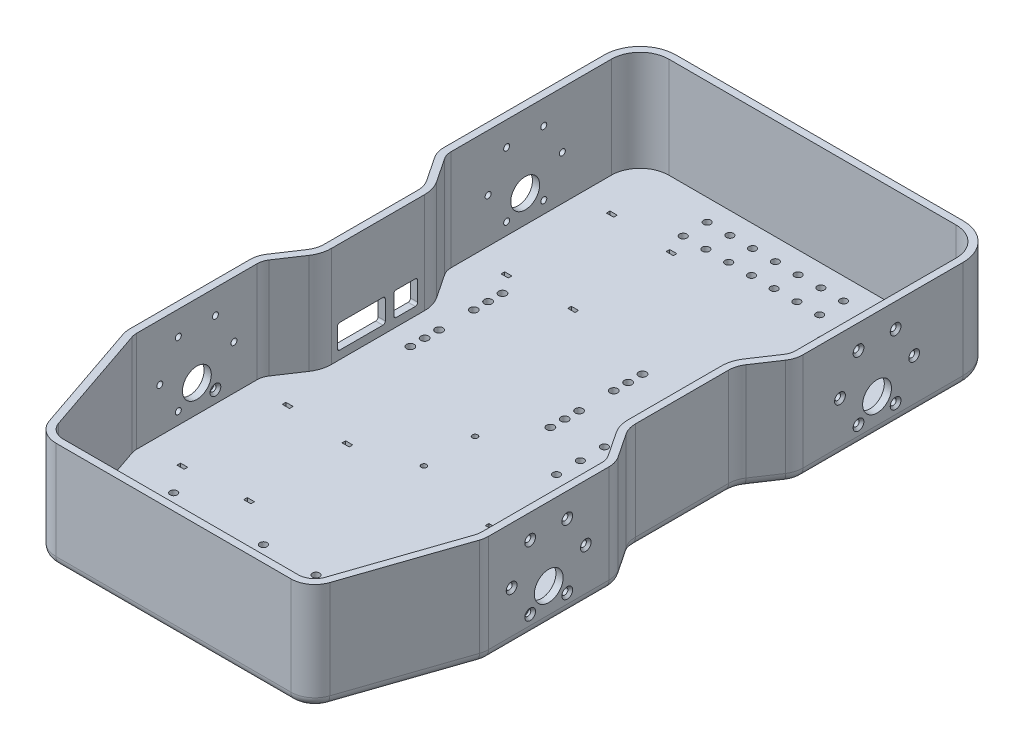
from build123d import *

# Parameters (mm, degrees)
BOSS_EXTRUDE1_DEPTH     = 45
SHELL1_T                = -3
CUT_EXTRUDE1_DEPTH      = 10
CUT_EXTRUDE1_DEPTH_BACK = 200
CUT_EXTRUDE2_DEPTH      = 10
CUT_EXTRUDE2_DEPTH_BACK = 200
CHAMFER1_SIZE           = 1
CHAMFER2_SIZE           = 1
CHAMFER3_SIZE           = 1
CHAMFER4_SIZE           = 1
SKETCH13_15_R           = 1.25
CUT_EXTRUDE11_DEPTH     = 214.424459704
CHAMFER5_SIZE           = 1
CUT_EXTRUDE12_DEPTH     = 214.424459704
FILLET1_R               = 4
CUT_EXTRUDE5_DEPTH      = 169.564527834
SKETCH19_R              = 1.125
CUT_EXTRUDE6_DEPTH      = 169.564527834
CUT_EXTRUDE7_DEPTH      = 10
SKETCH21_W              = 13.129743387
SKETCH21_H              = 8.501594807
CUT_EXTRUDE13_DEPTH     = 10
SKETCH25_W              = 3
SKETCH25_H              = 1.5
CUT_EXTRUDE14_DEPTH     = 10
CUT_EXTRUDE15_DEPTH     = 4
SKETCH31_R              = 1.6
CUT_EXTRUDE20_DEPTH     = 4
SKETCH32_R              = 1.5
CUT_EXTRUDE21_DEPTH     = 3


with BuildPart() as part:
    # Sketch1 → Boss-Extrude1 (new body)
    with BuildSketch(Plane(origin=(0, 0, 0), x_dir=(1, 0, 0), z_dir=(0, 1, 0))):
        with BuildLine():
            Line((-74.465101882, -71.56903448), (-58.559066155, -118.226739278))
            ThreePointArc((-58.559066155, -118.226739278), (-54.913440505, -123.132262686), (-49.093964273, -125))
            Line((-49.093964273, -125), (49.093964273, -125))
            ThreePointArc((49.093964273, -125), (54.913440505, -123.132262686), (58.559066155, -118.226739278))
            Line((58.559066155, -118.226739278), (74.465101882, -71.56903448))
            ThreePointArc((74.465101882, -71.56903448), (74.865369198, -69.977682187), (75, -68.342295202))
            Line((75, -68.342295202), (75, -18.027756377))
            ThreePointArc((75, -18.027756377), (74.570920265, -15.12991489), (73.320502943, -12.480754415))
            Line((73.320502943, -12.480754415), (66.679497057, -2.519245585))
            ThreePointArc((66.679497057, -2.519245585), (65.429079735, 0.12991489), (65, 3.027756377))
            Line((65, 3.027756377), (65, 41.972243623))
            ThreePointArc((65, 41.972243623), (65.429079735, 44.87008511), (66.679497057, 47.519245585))
            Line((66.679497057, 47.519245585), (73.320502943, 57.480754415))
            ThreePointArc((73.320502943, 57.480754415), (74.570920265, 60.12991489), (75, 63.027756377))
            Line((75, 63.027756377), (75, 130))
            ThreePointArc((75, 130), (70.606601718, 140.606601718), (60, 145))
            Line((60, 145), (-60, 145))
            ThreePointArc((-60, 145), (-70.606601718, 140.606601718), (-75, 130))
            Line((-75, 130), (-75, 63.027756377))
            ThreePointArc((-75, 63.027756377), (-74.570920265, 60.12991489), (-73.320502943, 57.480754415))
            Line((-73.320502943, 57.480754415), (-66.679497057, 47.519245585))
            ThreePointArc((-66.679497057, 47.519245585), (-65.429079735, 44.87008511), (-65, 41.972243623))
            Line((-65, 41.972243623), (-65, 3.027756377))
            ThreePointArc((-65, 3.027756377), (-65.429079735, 0.12991489), (-66.679497057, -2.519245585))
            Line((-66.679497057, -2.519245585), (-73.320502943, -12.480754415))
            ThreePointArc((-73.320502943, -12.480754415), (-74.570920265, -15.12991489), (-75, -18.027756377))
            Line((-75, -18.027756377), (-75, -68.342295202))
            ThreePointArc((-75, -68.342295202), (-74.865369198, -69.977682187), (-74.465101882, -71.56903448))
        make_face()
    extrude(amount=BOSS_EXTRUDE1_DEPTH)

    # Shell1
    shell1_openings = [part.faces().sort_by_distance(p)[0] for p in [
        (0, 45, -12.493815774),
    ]]
    offset(amount=SHELL1_T, openings=shell1_openings, kind=Kind.INTERSECTION)

    # Sketch13 → Cut-Extrude1 (cut, two sides: drawn at the far end of the back side and taken through both)
    with BuildSketch(Plane.ZY.offset(75).offset(-CUT_EXTRUDE1_DEPTH_BACK)):
        with BuildLine():
            ThreePointArc((37.397452028, 12.811795054), (49.208164475, 14.511751893), (37.380230416, 16.087428779))
            ThreePointArc((37.380230416, 16.087428779), (37.161887105, 14.448418707), (37.397452028, 12.811795054))
        make_face()
    extrude(amount=CUT_EXTRUDE1_DEPTH + CUT_EXTRUDE1_DEPTH_BACK, mode=Mode.SUBTRACT)

    # Sketch13<7> → Cut-Extrude2 (cut, two sides: drawn at the far end of the back side and taken through both)
    with BuildSketch(Plane.ZY.offset(75).offset(-CUT_EXTRUDE2_DEPTH_BACK)):
        with BuildLine():
            ThreePointArc((34.185026884, 34.921739832), (36.685025385, 34.922388021), (34.185031164, 34.927059157))
            ThreePointArc((34.185031164, 34.927059157), (34.185026194, 34.924399497), (34.185026884, 34.921739832))
        make_face()
        with BuildLine():
            ThreePointArc((26.435026884, 21.498346073), (28.935025385, 21.498994262), (26.435031164, 21.503665398))
            ThreePointArc((26.435031164, 21.503665398), (26.435026194, 21.501005738), (26.435026884, 21.498346073))
        make_face()
        with BuildLine():
            ThreePointArc((34.185026884, 8.074952315), (36.685025385, 8.075600503), (34.185031164, 8.08027164))
            ThreePointArc((34.185031164, 8.08027164), (34.185026194, 8.077611979), (34.185026884, 8.074952315))
        make_face()
        with BuildLine():
            ThreePointArc((52.185024696, 8.074952315), (49.685026194, 8.075600503), (52.185020416, 8.08027164))
            ThreePointArc((52.185020416, 8.08027164), (52.185025385, 8.077611979), (52.185024696, 8.074952315))
        make_face()
        with BuildLine():
            ThreePointArc((59.935024696, 21.498346073), (57.435026194, 21.498994262), (59.935020416, 21.503665398))
            ThreePointArc((59.935020416, 21.503665398), (59.935025385, 21.501005738), (59.935024696, 21.498346073))
        make_face()
        with BuildLine():
            ThreePointArc((52.185024696, 34.921739832), (49.685026194, 34.922388021), (52.185020416, 34.927059157))
            ThreePointArc((52.185020416, 34.927059157), (52.185025385, 34.924399497), (52.185024696, 34.921739832))
        make_face()
    extrude(amount=CUT_EXTRUDE2_DEPTH + CUT_EXTRUDE2_DEPTH_BACK, mode=Mode.SUBTRACT)

    # Chamfer1
    chamfer1_edges = [part.edges().sort_by_distance(p)[0] for p in [
        (-75, 34.91972836, 36.685020416),
    ]]
    chamfer(chamfer1_edges, length=CHAMFER1_SIZE)

    # Chamfer2
    chamfer2_edges = [part.edges().sort_by_distance(p)[0] for p in [
        (-75, 34.91972836, 49.685031164),
        (-75, 21.498994262, 57.435026194),
        (-75, 8.072940843, 49.685031164),
        (-72, 8.072940843, 36.685020416),
        (-75, 21.496334602, 28.935020416),
    ]]
    chamfer(chamfer2_edges, length=CHAMFER2_SIZE)

    # Chamfer3
    chamfer3_edges = [part.edges().sort_by_distance(p)[0] for p in [
        (-75, 8.072940843, 36.685020416),
    ]]
    chamfer(chamfer3_edges, length=CHAMFER3_SIZE)

    # Chamfer4
    chamfer4_edges = [part.edges().sort_by_distance(p)[0] for p in [
        (75, 34.91972836, 49.685031163),
        (75, 21.501005738, 59.935025385),
        (75, 8.072940843, 49.685031163),
        (72, 8.072940843, 49.685031163),
        (75, 8.072940843, 36.685020416),
        (75, 21.496334602, 28.935020416),
        (75, 34.91972836, 36.685020416),
    ]]
    chamfer(chamfer4_edges, length=CHAMFER4_SIZE)

    # Sketch13<15> → Cut-Extrude11 (cut, through all)
    with BuildSketch(Plane.ZY.offset(75)):
        with Locations((-86.25, 8.076606241)):
            Circle(SKETCH13_15_R)
        with Locations((-101.75, 8.076606241)):
            Circle(SKETCH13_15_R)
        with Locations((-101.75, 34.923393759)):
            Circle(SKETCH13_15_R)
        with Locations((-109.5, 21.5)):
            Circle(SKETCH13_15_R)
        with Locations((-86.25, 34.923393759)):
            Circle(SKETCH13_15_R)
        with Locations((-78.5, 21.5)):
            Circle(SKETCH13_15_R)
    extrude(amount=-CUT_EXTRUDE11_DEPTH, mode=Mode.SUBTRACT)

    # Chamfer5
    chamfer5_edges = [part.edges().sort_by_distance(p)[0] for p in [
        (75, 21.5, -79.75),
        (-75, 21.5, -79.75),
        (75, 8.076606241, -103),
        (-75, 8.076606241, -103),
        (75, 34.923393759, -103),
        (-75, 34.923393759, -103),
        (75, 21.5, -110.75),
        (-75, 21.5, -110.75),
        (75, 34.923393759, -87.5),
        (-75, 34.923393759, -87.5),
        (75, 8.076606241, -87.5),
        (-75, 8.076606241, -87.5),
    ]]
    chamfer(chamfer5_edges, length=CHAMFER5_SIZE)

    # Sketch13<16> → Cut-Extrude12 (cut, through all)
    with BuildSketch(Plane.ZY.offset(75)):
        with BuildLine():
            ThreePointArc((-88.669474003, 11.675678948), (-87.976782318, 14.487237093), (-88.676148765, 17.297142349))
            ThreePointArc((-88.676148765, 17.297142349), (-100.023217682, 14.472933507), (-88.669474003, 11.675678948))
        make_face()
    extrude(amount=-CUT_EXTRUDE12_DEPTH, mode=Mode.SUBTRACT)

    # Fillet1
    fillet1_edges = [part.edges().sort_by_distance(p)[0] for p in [
        (0, 0, -145),
        (70.606601718, 0, -140.606601718),
        (75, 0, -96.513878189),
        (74.570920265, 0, -60.12991489),
        (70, 0, -52.5),
        (65.429079735, 0, -44.87008511),
        (65, 0, -22.5),
        (65.429079735, 0, -0.12991489),
        (70, 0, 7.5),
        (74.570920265, 0, 15.12991489),
        (75, 0, 43.18502579),
        (74.865369198, 0, 69.977682187),
        (66.512084019, 0, 94.897886879),
        (54.913440505, 0, 123.132262686),
        (0, 0, 125),
        (-54.913440505, 0, 123.132262686),
        (-66.512084019, 0, 94.897886879),
        (-74.865369198, 0, 69.977682187),
        (-75, 0, 43.18502579),
        (-74.570920265, 0, 15.12991489),
        (-70, 0, 7.5),
        (-65.429079735, 0, -0.12991489),
        (-65, 0, -22.5),
        (-65.429079735, 0, -44.87008511),
        (-70, 0, -52.5),
        (-74.570920265, 0, -60.12991489),
        (-75, 0, -96.513878189),
        (-70.606601718, 0, -140.606601718),
    ]]
    fillet(fillet1_edges, radius=FILLET1_R)

    # Sketch18 → Cut-Extrude5 (cut, through all)
    with BuildSketch(Plane(origin=(0, 3, 0), x_dir=(1, 0, 0), z_dir=(0, 1, 0))):
        with BuildLine():
            ThreePointArc((11, -77.873884082), (9.5, -76.373884082), (11, -74.873884082))
            ThreePointArc((11, -74.873884082), (12.5, -76.373884082), (11, -77.873884082))
        make_face()
        with BuildLine():
            ThreePointArc((48.5, -74.873884082), (50, -76.373884082), (48.5, -77.873884082))
            ThreePointArc((48.5, -77.873884082), (47, -76.373884082), (48.5, -74.873884082))
        make_face()
        with BuildLine():
            ThreePointArc((-48.5, -74.873884082), (-50, -76.373884082), (-48.5, -77.873884082))
            ThreePointArc((-48.5, -77.873884082), (-47, -76.373884082), (-48.5, -74.873884082))
        make_face()
        with BuildLine():
            ThreePointArc((48.5, -112.373884082), (50, -113.873884082), (48.5, -115.373884082))
            ThreePointArc((48.5, -115.373884082), (47, -113.873884082), (48.5, -112.373884082))
        make_face()
        with BuildLine():
            ThreePointArc((11, -112.373884082), (12.5, -113.873884082), (11, -115.373884082))
            ThreePointArc((11, -115.373884082), (9.5, -113.873884082), (11, -112.373884082))
        make_face()
        with BuildLine():
            ThreePointArc((-11, -112.373884082), (-12.5, -113.873884082), (-11, -115.373884082))
            ThreePointArc((-11, -115.373884082), (-9.5, -113.873884082), (-11, -112.373884082))
        make_face()
        with BuildLine():
            ThreePointArc((-48.5, -112.373884082), (-50, -113.873884082), (-48.5, -115.373884082))
            ThreePointArc((-48.5, -115.373884082), (-47, -113.873884082), (-48.5, -112.373884082))
        make_face()
        with BuildLine():
            ThreePointArc((-11, -74.873884082), (-12.5, -76.373884082), (-11, -77.873884082))
            ThreePointArc((-11, -77.873884082), (-9.5, -76.373884082), (-11, -74.873884082))
        make_face()
    extrude(amount=-CUT_EXTRUDE5_DEPTH, mode=Mode.SUBTRACT)

    # Sketch19 → Cut-Extrude6 (cut, through all)
    with BuildSketch(Plane(origin=(0, 3, 0), x_dir=(1, 0, 0), z_dir=(0, 1, 0))):
        with Locations(Location((-5.98, 7, 0), (0, 0, 270))):
            Circle(SKETCH19_R)
        with Locations(Location((56, 7, 0), (0, 0, 270))):
            Circle(SKETCH19_R)
        with Locations(Location((56, -14.34, 0), (0, 0, 270))):
            Circle(SKETCH19_R)
        with Locations(Location((-5.98, -14.34, 0), (0, 0, 270))):
            Circle(SKETCH19_R)
    extrude(amount=-CUT_EXTRUDE6_DEPTH, mode=Mode.SUBTRACT)

    # Sketch20 → Cut-Extrude7 (cut)
    with BuildSketch(Plane(origin=(0, 3, 0), x_dir=(1, 0, 0), z_dir=(0, 1, 0))):
        with BuildLine():
            ThreePointArc((-52.252784802, 50.920094989), (-52, 50.9), (-51.747215198, 50.920094989))
            ThreePointArc((-51.747215198, 50.920094989), (-52, 54.1), (-52.252784802, 50.920094989))
        make_face()
        with BuildLine():
            ThreePointArc((-52.252784802, 24.420094989), (-52, 24.4), (-51.747215198, 24.420094989))
            ThreePointArc((-51.747215198, 24.420094989), (-52, 27.6), (-52.252784802, 24.420094989))
        make_face()
        with BuildLine():
            ThreePointArc((6.247215198, 50.920094989), (6.5, 50.9), (6.752784802, 50.920094989))
            ThreePointArc((6.752784802, 50.920094989), (6.5, 54.1), (6.247215198, 50.920094989))
        make_face()
        with BuildLine():
            ThreePointArc((6.247215198, 24.420094989), (6.5, 24.4), (6.752784802, 24.420094989))
            ThreePointArc((6.752784802, 24.420094989), (6.5, 27.6), (6.247215198, 24.420094989))
        make_face()
    extrude(amount=-CUT_EXTRUDE7_DEPTH, mode=Mode.SUBTRACT)

    # Sketch21 → Cut-Extrude13 (cut)
    with BuildSketch(Plane(origin=(0, 3, 0), x_dir=(1, 0, 0), z_dir=(0, 1, 0))):
        with Locations((50.435128307, 127.749202596)):
            Rectangle(SKETCH21_W, SKETCH21_H)
    extrude(amount=-CUT_EXTRUDE13_DEPTH, mode=Mode.SUBTRACT)

    # Sketch25 → Cut-Extrude14 (cut)
    with BuildSketch(Plane(origin=(0, 3, 0), x_dir=(1, 0, 0), z_dir=(0, 1, 0))):
        with Locations((57.83266841, 116.000691444)):
            Rectangle(SKETCH25_W, SKETCH25_H)
        with Locations((31.421905412, 114.546650207)):
            Rectangle(SKETCH25_W, SKETCH25_H)
        with Locations((57.83266841, 71.999308556)):
            Rectangle(SKETCH25_W, SKETCH25_H)
        with Locations((31.421905412, 73.453349793)):
            Rectangle(SKETCH25_W, SKETCH25_H)
        with Locations((-57.83266841, 71.999308556)):
            Rectangle(SKETCH25_W, SKETCH25_H)
        with Locations((-31.421905412, 73.453349793)):
            Rectangle(SKETCH25_W, SKETCH25_H)
        with Locations((-57.83266841, 116.000691444)):
            Rectangle(SKETCH25_W, SKETCH25_H)
        with Locations((-31.421905412, 114.546650207)):
            Rectangle(SKETCH25_W, SKETCH25_H)
        with Locations((29.921905412, -22.372943611)):
            Rectangle(SKETCH25_W, SKETCH25_H)
        with Locations((56.33266841, -20.918902374)):
            Rectangle(SKETCH25_W, SKETCH25_H)
        with Locations((29.921905412, -63.466244024)):
            Rectangle(SKETCH25_W, SKETCH25_H)
        with Locations((56.33266841, -64.920285262)):
            Rectangle(SKETCH25_W, SKETCH25_H)
        with Locations((-29.921905412, -63.466244024)):
            Rectangle(SKETCH25_W, SKETCH25_H)
        with Locations((-56.33266841, -64.920285262)):
            Rectangle(SKETCH25_W, SKETCH25_H)
        with Locations((-56.33266841, -20.918902374)):
            Rectangle(SKETCH25_W, SKETCH25_H)
        with Locations((-29.921905412, -22.372943611)):
            Rectangle(SKETCH25_W, SKETCH25_H)
    extrude(amount=-CUT_EXTRUDE14_DEPTH, mode=Mode.SUBTRACT)

    # Sketch26 → Cut-Extrude15 (cut)
    with BuildSketch(Plane.ZY.offset(65)):
        with BuildLine():
            Line((-24.532897328, 16.473362657), (-6.532897328, 16.473362657))
            ThreePointArc((-6.532897328, 16.473362657), (-5.825790547, 16.180469439), (-5.532897328, 15.473362657))
            Line((-5.532897328, 15.473362657), (-5.532897328, 7.473362657))
            ThreePointArc((-5.532897328, 7.473362657), (-5.825790547, 6.766255876), (-6.532897328, 6.473362657))
            Line((-6.532897328, 6.473362657), (-24.532897328, 6.473362657))
            ThreePointArc((-24.532897328, 6.473362657), (-25.240004109, 6.766255876), (-25.532897328, 7.473362657))
            Line((-25.532897328, 7.473362657), (-25.532897328, 15.473362657))
            ThreePointArc((-25.532897328, 15.473362657), (-25.240004109, 16.180469439), (-24.532897328, 16.473362657))
        make_face()
        with BuildLine():
            Line((-38.094139961, 16.473362657), (-30.094139961, 16.473362657))
            ThreePointArc((-30.094139961, 16.473362657), (-29.387033179, 16.180469439), (-29.094139961, 15.473362657))
            Line((-29.094139961, 15.473362657), (-29.094139961, 7.473362657))
            ThreePointArc((-29.094139961, 7.473362657), (-29.387033179, 6.766255876), (-30.094139961, 6.473362657))
            Line((-30.094139961, 6.473362657), (-38.094139961, 6.473362657))
            ThreePointArc((-38.094139961, 6.473362657), (-38.801246742, 6.766255876), (-39.094139961, 7.473362657))
            Line((-39.094139961, 7.473362657), (-39.094139961, 15.473362657))
            ThreePointArc((-39.094139961, 15.473362657), (-38.801246742, 16.180469439), (-38.094139961, 16.473362657))
        make_face()
    extrude(amount=-CUT_EXTRUDE15_DEPTH, mode=Mode.SUBTRACT)

    # Sketch31 → Cut-Extrude20 (cut)
    with BuildSketch(Plane(origin=(0, 3, 0), x_dir=(1, 0, 0), z_dir=(0, 1, 0))):
        with Locations(Location((6.5, 58.5, 0), (0, 0, 270))):
            Circle(SKETCH31_R)
        with Locations(Location((6.5, 32, 0), (0, 0, 270))):
            Circle(SKETCH31_R)
        with Locations(Location((-52.004332332, 58.5, 0), (0, 0, 270))):
            Circle(SKETCH31_R)
        with Locations(Location((-52.034402265, 32, 0), (0, 0, 270))):
            Circle(SKETCH31_R)
        with Locations(Location((-52, 64.5, 0), (0, 0, 270))):
            Circle(SKETCH31_R)
        with Locations(Location((6.5, 38, 0), (0, 0, 270))):
            Circle(SKETCH31_R)
        with Locations(Location((6.5, 64.5, 0), (0, 0, 270))):
            Circle(SKETCH31_R)
        with Locations(Location((-52, 38, 0), (0, 0, 270))):
            Circle(SKETCH31_R)
    extrude(amount=-CUT_EXTRUDE20_DEPTH, mode=Mode.SUBTRACT)

    # Sketch32 → Cut-Extrude21 (cut)
    with BuildSketch(Plane(origin=(0, 3, 0), x_dir=(1, 0, 0), z_dir=(0, 1, 0))):
        with Locations(Location((24.844950164, 50.209407022, 0), (0, 0, 270))):
            Circle(SKETCH32_R)
        with Locations(Location((24.844950164, 40.209407022, 0), (0, 0, 270))):
            Circle(SKETCH32_R)
        with Locations(Location((24.844950164, 30.209407022, 0), (0, 0, 270))):
            Circle(SKETCH32_R)
        with Locations(Location((24.844950164, 20.209407022, 0), (0, 0, 270))):
            Circle(SKETCH32_R)
        with Locations(Location((24.844950164, 10.209407022, 0), (0, 0, 270))):
            Circle(SKETCH32_R)
        with Locations(Location((34.844950164, 50.209407022, 0), (0, 0, 270))):
            Circle(SKETCH32_R)
        with Locations(Location((34.844950164, 40.209407022, 0), (0, 0, 270))):
            Circle(SKETCH32_R)
        with Locations(Location((34.844950164, 30.209407022, 0), (0, 0, 270))):
            Circle(SKETCH32_R)
        with Locations(Location((34.844950164, 20.209407022, 0), (0, 0, 270))):
            Circle(SKETCH32_R)
        with Locations(Location((34.844950164, 10.209407022, 0), (0, 0, 270))):
            Circle(SKETCH32_R)
        with Locations(Location((44.844950164, 50.209407022, 0), (0, 0, 270))):
            Circle(SKETCH32_R)
        with Locations(Location((44.844950164, 40.209407022, 0), (0, 0, 270))):
            Circle(SKETCH32_R)
        with Locations(Location((44.844950164, 30.209407022, 0), (0, 0, 270))):
            Circle(SKETCH32_R)
        with Locations(Location((44.844950164, 20.209407022, 0), (0, 0, 270))):
            Circle(SKETCH32_R)
        with Locations(Location((44.844950164, 10.209407022, 0), (0, 0, 270))):
            Circle(SKETCH32_R)
        with Locations(Location((-34.968714582, 132.976340705, 0), (0, 0, 270))):
            Circle(SKETCH32_R)
        with Locations(Location((-25.468714582, 132.976340705, 0), (0, 0, 270))):
            Circle(SKETCH32_R)
        with Locations(Location((-15.968714582, 132.976340705, 0), (0, 0, 270))):
            Circle(SKETCH32_R)
        with Locations(Location((-6.468714582, 132.976340705, 0), (0, 0, 270))):
            Circle(SKETCH32_R)
        with Locations(Location((3.031285418, 132.976340705, 0), (0, 0, 270))):
            Circle(SKETCH32_R)
        with Locations(Location((12.531285418, 132.976340705, 0), (0, 0, 270))):
            Circle(SKETCH32_R)
        with Locations(Location((22.031285418, 132.976340705, 0), (0, 0, 270))):
            Circle(SKETCH32_R)
        with Locations(Location((31.531285418, 132.976340705, 0), (0, 0, 270))):
            Circle(SKETCH32_R)
        with Locations(Location((-34.968714582, 122.976340705, 0), (0, 0, 270))):
            Circle(SKETCH32_R)
        with Locations(Location((-25.468714582, 122.976340705, 0), (0, 0, 270))):
            Circle(SKETCH32_R)
        with Locations(Location((-15.968714582, 122.976340705, 0), (0, 0, 270))):
            Circle(SKETCH32_R)
        with Locations(Location((-6.468714582, 122.976340705, 0), (0, 0, 270))):
            Circle(SKETCH32_R)
        with Locations(Location((3.031285418, 122.976340705, 0), (0, 0, 270))):
            Circle(SKETCH32_R)
        with Locations(Location((12.531285418, 122.976340705, 0), (0, 0, 270))):
            Circle(SKETCH32_R)
        with Locations(Location((22.031285418, 122.976340705, 0), (0, 0, 270))):
            Circle(SKETCH32_R)
        with Locations(Location((31.531285418, 122.976340705, 0), (0, 0, 270))):
            Circle(SKETCH32_R)
    extrude(amount=-CUT_EXTRUDE21_DEPTH, mode=Mode.SUBTRACT)


solid = part.part
